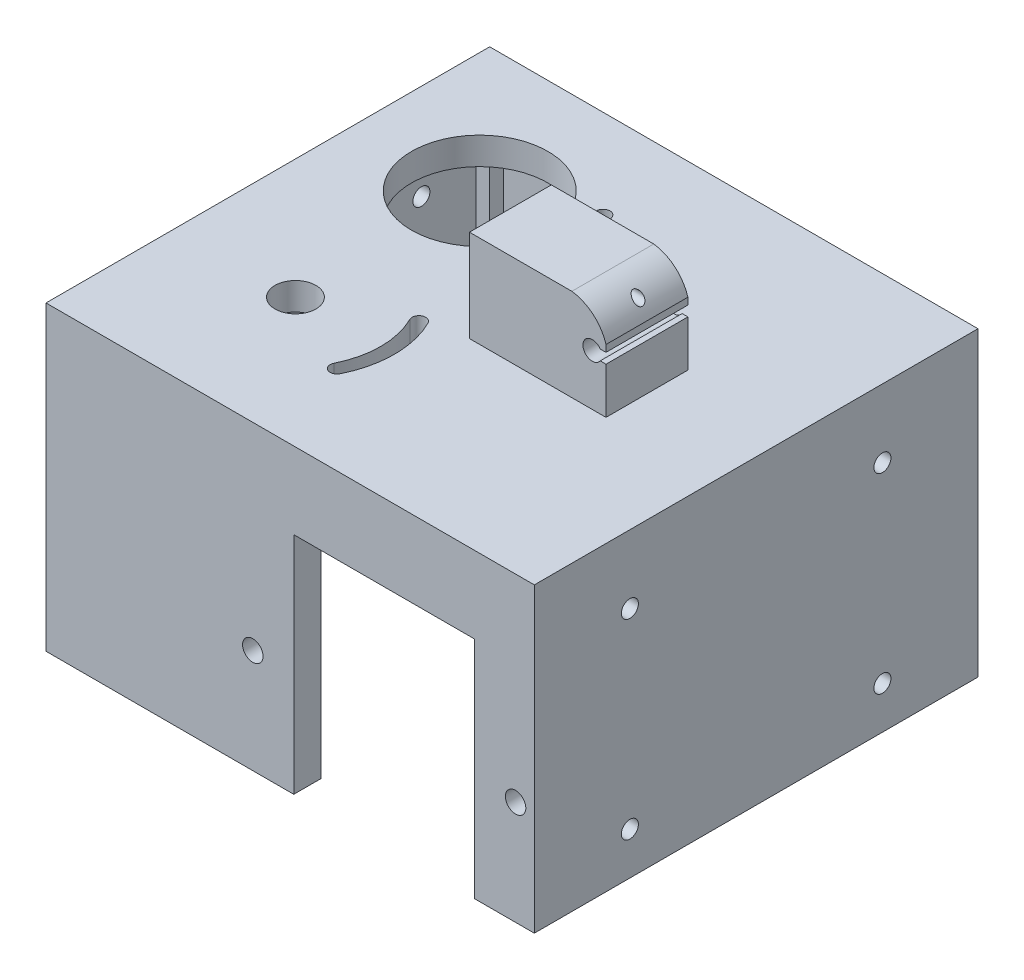
from build123d import *

# Parameters (mm, degrees)
SKETCH1_W                = 64
SKETCH1_H                = 50
BOSS_EXTRUDE1_DEPTH      = 4
SKETCH3_R                = 6.5
CUT_EXTRUDE2_DEPTH       = 4
SKETCH4_W                = 20
SKETCH4_H                = 12
BOSS_EXTRUDE2_DEPTH      = 13.5
CUT_EXTRUDE3_DEPTH       = 47.984039843
CUT_EXTRUDE3_DEPTH_BACK  = 47.984039843
CUT_EXTRUDE4_DEPTH       = 47.984039843
CUT_EXTRUDE4_DEPTH_BACK  = 47.984039843
CUT_EXTRUDE5_DEPTH       = 57.588426379
CUT_EXTRUDE5_DEPTH_BACK  = 57.588426379
SKETCH7_R                = 0.75
CUT_EXTRUDE6_DEPTH       = 54.584046158
CUT_EXTRUDE6_DEPTH_BACK  = 54.584046158
SKETCH8_R                = 1
CUT_EXTRUDE7_DEPTH       = 54.584046158
CUT_EXTRUDE7_DEPTH_BACK  = 54.584046158
SKETCH10_R               = 3
CUT_EXTRUDE8_DEPTH       = 54.584046158
CUT_EXTRUDE8_DEPTH_BACK  = 54.584046158
SKETCH12_W               = 64
SKETCH12_H               = 5
BOSS_EXTRUDE3_DEPTH      = 4
BOSS_EXTRUDE4_DEPTH      = 4
BOSS_EXTRUDE5_DEPTH      = 40.2
SKETCH17_W               = 26.5
SKETCH17_H               = 4
BOSS_EXTRUDE7_DEPTH      = 7.25
SKETCH19_W               = 2
SKETCH19_H               = 7
SKETCH19_H_2             = 2
BOSS_EXTRUDE8_DEPTH      = 40.2
CUT_EXTRUDE9_DEPTH       = 86.529836515
CUT_EXTRUDE9_DEPTH_BACK  = 4
SKETCH18_R               = 1.5
CUT_EXTRUDE10_DEPTH      = 86.599046003
CUT_EXTRUDE10_DEPTH_BACK = 4
SKETCH20_R               = 1.5
SKETCH21_R               = 1.5
CUT_EXTRUDE11_DEPTH      = 4
CUT_EXTRUDE12_DEPTH      = 97.099435462
CUT_EXTRUDE12_DEPTH_BACK = 97.099435462
SKETCH22_R               = 1.25
SKETCH15_W               = 40
SKETCH15_H               = 24.2
CUT_EXTRUDE13_DEPTH      = 10
SKETCH23_R               = 10
CUT_EXTRUDE14_DEPTH      = 78.069468162


with BuildPart() as part:
    # Sketch1 → Boss-Extrude1 (new body)
    with BuildSketch(Plane(origin=(0, 0, 0), x_dir=(1, 0, 0), z_dir=(0, 1, 0))):
        with Locations((1, 15)):
            Rectangle(SKETCH1_W, SKETCH1_H)
    extrude(amount=BOSS_EXTRUDE1_DEPTH)

    # Sketch3 → Cut-Extrude2 (cut)
    with BuildSketch(Plane(origin=(0, 4, 0), x_dir=(1, 0, 0), z_dir=(0, 1, 0))):
        with Locations(Location((-21, 31, 0), (0, 0, 270))):
            Circle(SKETCH3_R)
    extrude(amount=-CUT_EXTRUDE2_DEPTH, mode=Mode.SUBTRACT)

    # Sketch4 → Boss-Extrude2 (add)
    with BuildSketch(Plane(origin=(0, 4, 0), x_dir=(1, 0, 0), z_dir=(0, 1, 0))):
        with Locations((7, 17.5)):
            Rectangle(SKETCH4_W, SKETCH4_H)
    extrude(amount=BOSS_EXTRUDE2_DEPTH)

    # Sketch5 → Cut-Extrude3 (cut, two sides: drawn at the far end of the back side and taken through both)
    with BuildSketch(Plane.XY.offset(-11.5).offset(-CUT_EXTRUDE3_DEPTH_BACK)):
        with BuildLine():
            Line((17, 10.75), (16.152443057, 10.75))
            ThreePointArc((16.152443057, 10.75), (13.625, 11.5), (16.152443057, 12.25))
            Line((16.152443057, 12.25), (19, 12.25))
            Line((19, 12.25), (22.19672231, 12.25))
            Line((22.19672231, 12.25), (22.19672231, 10.75))
            Line((22.19672231, 10.75), (17, 10.75))
        make_face()
    extrude(amount=CUT_EXTRUDE3_DEPTH + CUT_EXTRUDE3_DEPTH_BACK, mode=Mode.SUBTRACT)

    # Sketch6 → Cut-Extrude4 (cut, two sides: drawn at the far end of the back side and taken through both)
    with BuildSketch(Plane.XY.offset(-11.5).offset(-CUT_EXTRUDE4_DEPTH_BACK)):
        with BuildLine():
            Line((12, 17.5), (17, 17.5))
            Line((17, 17.5), (17, 13.25))
            ThreePointArc((17, 13.25), (15.124760231, 16.110012037), (12, 17.5))
        make_face()
    extrude(amount=CUT_EXTRUDE4_DEPTH + CUT_EXTRUDE4_DEPTH_BACK, mode=Mode.SUBTRACT)

    # Sketch7 → Cut-Extrude5 (cut, two sides: drawn at the far end of the back side and taken through both)
    with BuildSketch(Plane.ZY.offset(3).offset(-CUT_EXTRUDE5_DEPTH_BACK)):
        with Locations((-17.5, 15.5)):
            Circle(SKETCH7_R)
    extrude(amount=CUT_EXTRUDE5_DEPTH + CUT_EXTRUDE5_DEPTH_BACK, mode=Mode.SUBTRACT)

    # Sketch8 → Cut-Extrude6 (cut, two sides: drawn at the far end of the back side and taken through both)
    with BuildSketch(Plane(origin=(0, 4, 0), x_dir=(1, 0, 0), z_dir=(0, 1, 0)).offset(-CUT_EXTRUDE6_DEPTH_BACK)):
        with Locations(Location((-7.5, 31, 0), (0, 0, 270))):
            Circle(SKETCH8_R)
        with Locations(Location((-7.5, 17.5, 0), (0, 0, 270))):
            Circle(SKETCH8_R)
        with Locations(Location((-7.5, 4, 0), (0, 0, 270))):
            Circle(SKETCH8_R)
    extrude(amount=CUT_EXTRUDE6_DEPTH + CUT_EXTRUDE6_DEPTH_BACK, mode=Mode.SUBTRACT)

    # Sketch10 → Cut-Extrude7 (cut, two sides: drawn at the far end of the back side and taken through both)
    with BuildSketch(Plane(origin=(0, 4, 0), x_dir=(1, 0, 0), z_dir=(0, 1, 0)).offset(-CUT_EXTRUDE7_DEPTH_BACK)):
        with Locations(Location((-21, 4, 0), (0, 0, 270))):
            Circle(SKETCH10_R)
    extrude(amount=CUT_EXTRUDE7_DEPTH + CUT_EXTRUDE7_DEPTH_BACK, mode=Mode.SUBTRACT)

    # Sketch11 → Cut-Extrude8 (cut, two sides: drawn at the far end of the back side and taken through both)
    with BuildSketch(Plane(origin=(0, 4, 0), x_dir=(1, 0, 0), z_dir=(0, 1, 0)).offset(-CUT_EXTRUDE8_DEPTH_BACK)):
        with BuildLine():
            ThreePointArc((-9.802419794, 25.444444444), (-8.5, 31), (-9.802419794, 36.555555556))
            ThreePointArc((-9.802419794, 36.555555556), (-9.351057822, 37.895806416), (-8.010806961, 37.444444444))
            ThreePointArc((-8.010806961, 37.444444444), (-6.5, 31), (-8.010806961, 24.555555556))
            ThreePointArc((-8.010806961, 24.555555556), (-9.351057822, 24.104193584), (-9.802419794, 25.444444444))
        make_face()
        with BuildLine():
            ThreePointArc((-9.802419794, 9.555555556), (-8.5, 4), (-9.802419794, -1.555555556))
            ThreePointArc((-9.802419794, -1.555555556), (-9.351057822, -2.895806416), (-8.010806961, -2.444444444))
            ThreePointArc((-8.010806961, -2.444444444), (-6.5, 4), (-8.010806961, 10.444444444))
            ThreePointArc((-8.010806961, 10.444444444), (-9.351057822, 10.895806416), (-9.802419794, 9.555555556))
        make_face()
    extrude(amount=CUT_EXTRUDE8_DEPTH + CUT_EXTRUDE8_DEPTH_BACK, mode=Mode.SUBTRACT)

    # Sketch12 → Boss-Extrude3 (add)
    with BuildSketch(Plane(origin=(0, 4, 0), x_dir=(1, 0, 0), z_dir=(0, 1, 0))):
        with Locations((1, 42.5)):
            Rectangle(SKETCH12_W, SKETCH12_H)
        with Locations((1, -12.5)):
            Rectangle(SKETCH12_W, SKETCH12_H)
    extrude(amount=-BOSS_EXTRUDE3_DEPTH)

    # Sketch13 → Boss-Extrude4 (add)
    with BuildSketch(Plane(origin=(0, 0, 0), x_dir=(1, 0, 0), z_dir=(0, 1, 0))):
        Polygon((33, 38.853125133), (-31, 38.853125133), (-31, -15), (-38.545432929, -15), (-38.545432929, 50.003125133), (-31, 50.003125133), (33, 50.003125133), align=None)
    extrude(amount=BOSS_EXTRUDE4_DEPTH)

    # Sketch14 → Boss-Extrude5 (add)
    with BuildSketch(Plane.XZ):
        Polygon((-38.545432929, 15), (-2.245432929, 15), (-2.245432929, 11), (-34.545432929, 11), (-34.545432929, -46.003125133), (29, -46.003125133), (29, 11), (24.254567071, 11), (24.254567071, 15), (33, 15), (33, 4.2), (33, -50.003125133), (29, -50.003125133), (-34.545432929, -50.003125133), (-38.545432929, -50.003125133), (-38.545432929, 4.2), align=None)
    extrude(amount=BOSS_EXTRUDE5_DEPTH)

    # Sketch17 → Boss-Extrude7 (add)
    with BuildSketch(Plane.XZ):
        with Locations((11.004567071, 13)):
            Rectangle(SKETCH17_W, SKETCH17_H)
    extrude(amount=BOSS_EXTRUDE7_DEPTH)

    # Sketch19 → Boss-Extrude8 (add)
    with BuildSketch(Plane.XZ.offset(40.2)):
        with Locations((-33.545432929, 7.5)):
            Rectangle(SKETCH19_W, SKETCH19_H)
        with Locations((-33.545432929, -45.003125133)):
            Rectangle(SKETCH19_W, SKETCH19_H_2)
        with Locations((28, -45.003125133)):
            Rectangle(SKETCH19_W, SKETCH19_H_2)
        with Locations((28, 7.5)):
            Rectangle(SKETCH19_W, SKETCH19_H)
    extrude(amount=-BOSS_EXTRUDE8_DEPTH)

    # Sketch18 → Cut-Extrude9 (cut, two sides: drawn at the far end of the back side and taken through both)
    with BuildSketch(Plane.XZ.offset(40.2).offset(-CUT_EXTRUDE9_DEPTH_BACK)):
        with Locations(Location((-35.545432929, 7, 0), (0, 0, 90))):
            Circle(SKETCH18_R)
        with Locations(Location((30, 7, 0), (0, 0, 90))):
            Circle(SKETCH18_R)
        with Locations(Location((30, -47.003125133, 0), (0, 0, 90))):
            Circle(SKETCH18_R)
        with Locations(Location((-35.545432929, -47.003125133, 0), (0, 0, 90))):
            Circle(SKETCH18_R)
    extrude(amount=CUT_EXTRUDE9_DEPTH + CUT_EXTRUDE9_DEPTH_BACK, mode=Mode.SUBTRACT)

    # Sketch20 → Cut-Extrude10 (cut, two sides: drawn at the far end of the back side and taken through both)
    with BuildSketch(Plane.XY.offset(15).offset(-CUT_EXTRUDE10_DEPTH_BACK)):
        with Locations(Location((-8.245432929, -24.95, 0), (0, 0, 180))):
            Circle(SKETCH20_R)
        with Locations(Location((30.254567071, -24.95, 0), (0, 0, 180))):
            Circle(SKETCH20_R)
    extrude(amount=CUT_EXTRUDE10_DEPTH + CUT_EXTRUDE10_DEPTH_BACK, mode=Mode.SUBTRACT)

    # Sketch21 → Cut-Extrude11 (cut)
    with BuildSketch(Plane(origin=(0, 0, -50.003125133), x_dir=(-1, 0, 0), z_dir=(0, 0, -1))):
        with Locations((-4.227283535, 0)):
            Circle(SKETCH21_R)
        with Locations((-14.227283535, 0)):
            Circle(SKETCH21_R)
    extrude(amount=-CUT_EXTRUDE11_DEPTH, mode=Mode.SUBTRACT)

    # Sketch22 → Cut-Extrude12 (cut, two sides: drawn at the far end of the back side and taken through both)
    with BuildSketch(Plane(origin=(33, 0, 0), x_dir=(0, 0, -1), z_dir=(1, 0, 0)).offset(-CUT_EXTRUDE12_DEPTH_BACK)):
        with Locations((-1, -6)):
            Circle(SKETCH22_R)
        with Locations((36, -34)):
            Circle(SKETCH22_R)
        with Locations((-1, -34)):
            Circle(SKETCH22_R)
        with Locations((36, -6)):
            Circle(SKETCH22_R)
    extrude(amount=CUT_EXTRUDE12_DEPTH + CUT_EXTRUDE12_DEPTH_BACK, mode=Mode.SUBTRACT)

    # Sketch15 → Cut-Extrude13 (cut)
    with BuildSketch(Plane.XY.offset(-46.003125133)):
        with Locations((4.254567071, -18.1)):
            Rectangle(SKETCH15_W, SKETCH15_H)
    extrude(amount=-CUT_EXTRUDE13_DEPTH, mode=Mode.SUBTRACT)

    # Sketch23 → Cut-Extrude14 (cut, through all)
    with BuildSketch(Plane(origin=(0, 4, 0), x_dir=(1, 0, 0), z_dir=(0, 1, 0))):
        with Locations(Location((-21, 31, 0), (0, 0, 270))):
            Circle(SKETCH23_R)
    extrude(amount=-CUT_EXTRUDE14_DEPTH, mode=Mode.SUBTRACT)


solid = part.part
